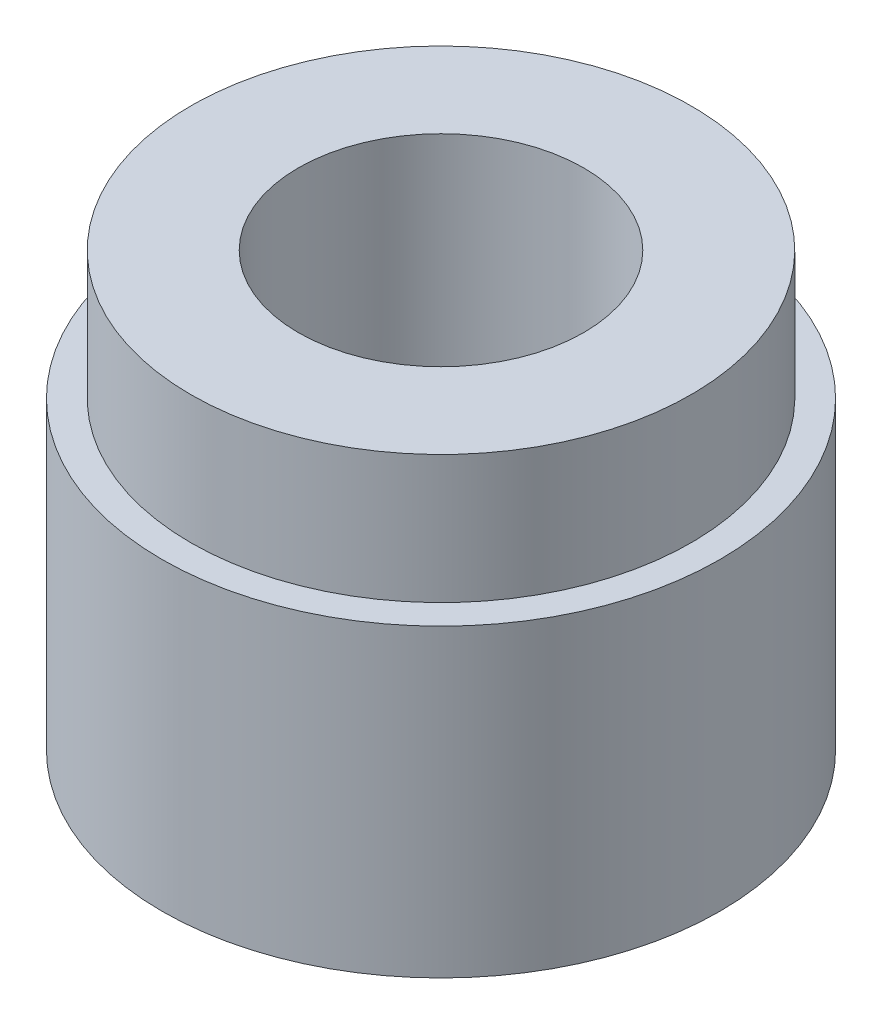
from build123d import *

# Parameters (mm, degrees)
SKETCH1_R                 = 2.2098
BOSS_EXTRUDE1_DEPTH       = 3.429
SKETCH2_OUTSIDE_W         = 7.846
SKETCH2_OUTSIDE_H         = 7.846
SKETCH2_OUTSIDE_R         = 1.9812
CUT_EXTRUDE1_DEPTH        = 1.016
F_4_40_TAPPED_HOLE1_D     = 2.2606
F_4_40_TAPPED_HOLE1_DEPTH = 8.8646
F_4_40_TAPPED_HOLE1_TIP   = 0.679152758


with BuildPart() as part:
    # Sketch1 → Boss-Extrude1 (new body)
    with BuildSketch(Plane(origin=(0, 0, 0), x_dir=(1, 0, 0), z_dir=(0, 1, 0))):
        with Locations(Location((0, 0, 0), (0, 0, 270))):
            Circle(SKETCH1_R)
    extrude(amount=BOSS_EXTRUDE1_DEPTH)

    # Sketch2 outside → Cut-Extrude1 (cut)
    with BuildSketch(Plane(origin=(0, 3.429, 0), x_dir=(1, 0, 0), z_dir=(0, 1, 0))):
        Rectangle(SKETCH2_OUTSIDE_W, SKETCH2_OUTSIDE_H)
        with Locations(Location((0, 0, 0), (0, 0, 270))):
            Circle(SKETCH2_OUTSIDE_R, mode=Mode.SUBTRACT)
    extrude(amount=-CUT_EXTRUDE1_DEPTH, mode=Mode.SUBTRACT)

    # #4-40 Tapped Hole1
    with Locations(Plane(origin=(0, 0, 0), x_dir=(-1, 0, 0), z_dir=(0, -1, 0))):
        with Locations((0, 0)):
            Hole(F_4_40_TAPPED_HOLE1_D / 2, depth=F_4_40_TAPPED_HOLE1_DEPTH)
            with Locations((0, 0, -(F_4_40_TAPPED_HOLE1_DEPTH + F_4_40_TAPPED_HOLE1_TIP / 2))):  # 118° drill point
                Cone(0, F_4_40_TAPPED_HOLE1_D / 2, F_4_40_TAPPED_HOLE1_TIP, mode=Mode.SUBTRACT)


solid = part.part
